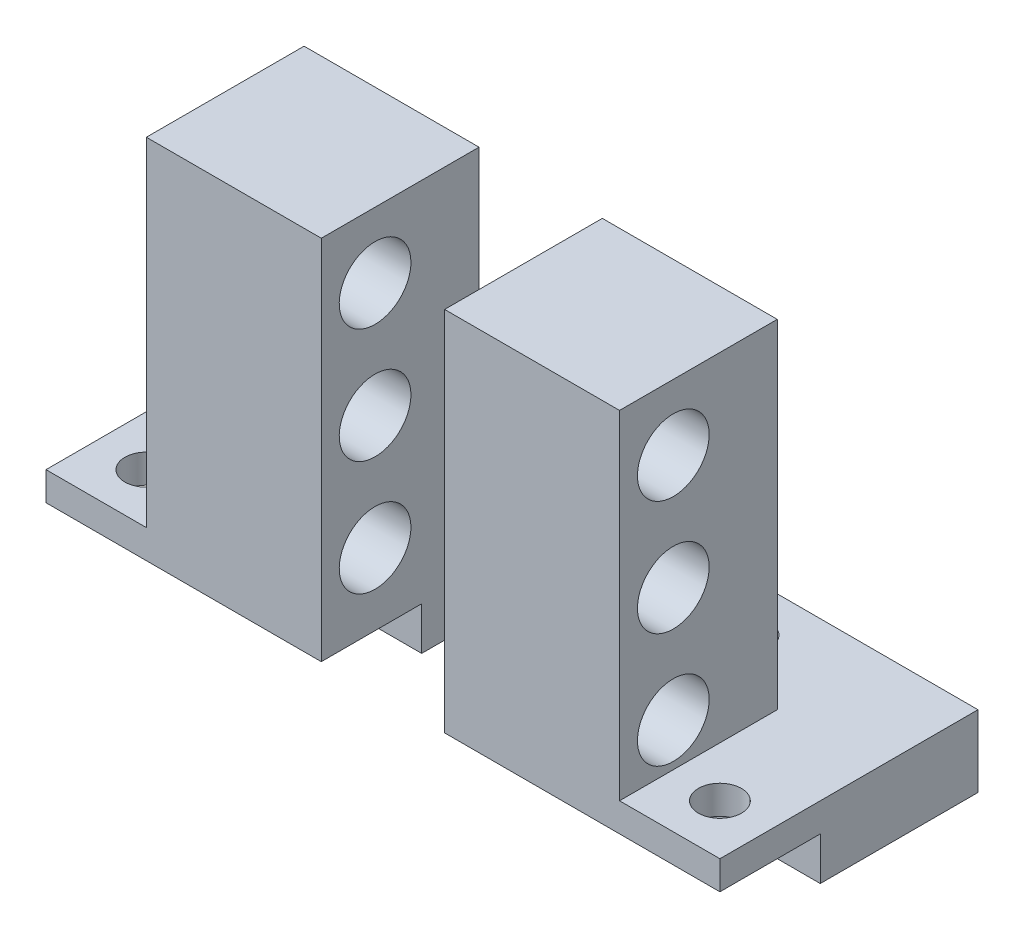
from build123d import *

# Parameters (mm, degrees)
BOSS_EXTRUDE1_DEPTH = 11
CUT_EXTRUDE1_REACH  = 37.52
SKETCH3_W           = 7
SKETCH3_H           = 3
CUT_EXTRUDE2_REACH  = 34.538
SKETCH4_R           = 2.5
SKETCH5_R           = 1.5
CUT_EXTRUDE3_DEPTH  = 11
SKETCH6_W           = 47
SKETCH6_H           = 5
BOSS_EXTRUDE2_DEPTH = 7
SKETCH7_R           = 1.5
CUT_EXTRUDE4_DEPTH  = 5
SKETCH9_R           = 2.5
BOSS_EXTRUDE3_DEPTH = 1.2
SKETCH10_R          = 2.5
BOSS_EXTRUDE4_DEPTH = 1.2


with BuildPart() as part:
    # Sketch1 → Boss-Extrude1 (new body)
    with BuildSketch(Plane.XY):
        Polygon((0, 0), (18, 0), (18, 28.578), (7, 28.578), (7, 5), (0, 5), align=None)
    extrude(amount=BOSS_EXTRUDE1_DEPTH)

    # Sketch3 → Cut-Extrude1 (cut, up to next)
    with BuildSketch(Plane.ZY, mode=Mode.PRIVATE) as cut_extrude1_sk1:
        with Locations((7.5, 1.5)):
            Rectangle(SKETCH3_W, SKETCH3_H)
    cut_extrude1_tool1 = extrude(cut_extrude1_sk1.sketch, amount=-CUT_EXTRUDE1_REACH, mode=Mode.PRIVATE) & part.part
    add(cut_extrude1_tool1.solids().sort_by_distance((0, 1.5, 7.5))[0], mode=Mode.SUBTRACT)

    # Sketch4 → Cut-Extrude2 (cut, up to next)
    with BuildSketch(Plane.ZY.offset(-7), mode=Mode.PRIVATE) as cut_extrude2_sk1:
        with Locations(Location((7.25, 8, 0), (0, 0, 270))):
            Circle(SKETCH4_R)
    cut_extrude2_tool1 = extrude(cut_extrude2_sk1.sketch, amount=-CUT_EXTRUDE2_REACH, mode=Mode.PRIVATE) & part.part
    # Sketch4 → Cut-Extrude2 (cut, up to next)
    with BuildSketch(Plane.ZY.offset(-7), mode=Mode.PRIVATE) as cut_extrude2_sk2:
        with Locations(Location((7.25, 16, 0), (0, 0, 270))):
            Circle(SKETCH4_R)
    cut_extrude2_tool2 = extrude(cut_extrude2_sk2.sketch, amount=-CUT_EXTRUDE2_REACH, mode=Mode.PRIVATE) & part.part
    # Sketch4 → Cut-Extrude2 (cut, up to next)
    with BuildSketch(Plane.ZY.offset(-7), mode=Mode.PRIVATE) as cut_extrude2_sk3:
        with Locations(Location((7.25, 24, 0), (0, 0, 270))):
            Circle(SKETCH4_R)
    cut_extrude2_tool3 = extrude(cut_extrude2_sk3.sketch, amount=-CUT_EXTRUDE2_REACH, mode=Mode.PRIVATE) & part.part
    add(cut_extrude2_tool1.solids().sort_by_distance((7, 8, 7.25))[0], mode=Mode.SUBTRACT)
    add(cut_extrude2_tool2.solids().sort_by_distance((7, 16, 7.25))[0], mode=Mode.SUBTRACT)
    add(cut_extrude2_tool3.solids().sort_by_distance((7, 24, 7.25))[0], mode=Mode.SUBTRACT)

    # Sketch5 → Cut-Extrude3 (cut)
    with BuildSketch(Plane(origin=(0, 5, 0), x_dir=(1, 0, 0), z_dir=(0, 1, 0))):
        with Locations(Location((3.5, -7.5, 0), (0, 0, 180))):
            Circle(SKETCH5_R)
    extrude(amount=-CUT_EXTRUDE3_DEPTH, mode=Mode.SUBTRACT)


with BuildPart() as body_2:
    # Mirror6: mirrored copy
    add(part.part.mirror(Plane(origin=(23.5, 0, 0), x_dir=(0, 0, 1), z_dir=(1, 0, 0))))


with BuildPart() as part_1:
    add(part.part)

    add(body_2.part)  # Boss-Extrude2 merges body 2
    # Sketch6 → Boss-Extrude2 (add)
    with BuildSketch(Plane(origin=(0, 0, 0), x_dir=(-1, 0, 0), z_dir=(0, 0, -1))):
        with Locations((-23.5, 2.5)):
            Rectangle(SKETCH6_W, SKETCH6_H)
    extrude(amount=BOSS_EXTRUDE2_DEPTH)

    # Sketch7 → Cut-Extrude4 (cut)
    with BuildSketch(Plane(origin=(0, 5, 0), x_dir=(1, 0, 0), z_dir=(0, 1, 0))):
        with Locations(Location((12.5, 3.5, 0), (0, 0, 180))):
            Circle(SKETCH7_R)
        with Locations(Location((34.5, 3.5, 0), (0, 0, 270))):
            Circle(SKETCH7_R)
    extrude(amount=-CUT_EXTRUDE4_DEPTH, mode=Mode.SUBTRACT)

    # Sketch9 → Boss-Extrude3 (add)
    with BuildSketch(Plane.ZY.offset(-29)):
        Polygon((11, 3), (11, 28.578), (0, 28.578), (0, 5), (0, 0), (4, 0), (4, 3), align=None)
        with Locations(Location((7.25, 24, 0), (0, 0, 270))):
            Circle(SKETCH9_R, mode=Mode.SUBTRACT)
        with Locations(Location((7.25, 16, 0), (0, 0, 270))):
            Circle(SKETCH9_R, mode=Mode.SUBTRACT)
        with Locations(Location((7.25, 8, 0), (0, 0, 270))):
            Circle(SKETCH9_R, mode=Mode.SUBTRACT)
    extrude(amount=BOSS_EXTRUDE3_DEPTH)

    # Sketch10 → Boss-Extrude4 (add)
    with BuildSketch(Plane(origin=(18, 0, 0), x_dir=(0, 0, -1), z_dir=(1, 0, 0))):
        Polygon((-11, 28.578), (-11, 3), (-4, 3), (-4, 0), (0, 0), (0, 5), (0, 28.578), align=None)
        with Locations(Location((-7.25, 8, 0), (0, 0, 270))):
            Circle(SKETCH10_R, mode=Mode.SUBTRACT)
        with Locations(Location((-7.25, 16, 0), (0, 0, 270))):
            Circle(SKETCH10_R, mode=Mode.SUBTRACT)
        with Locations(Location((-7.25, 24, 0), (0, 0, 270))):
            Circle(SKETCH10_R, mode=Mode.SUBTRACT)
    extrude(amount=BOSS_EXTRUDE4_DEPTH)


solid = part_1.part
